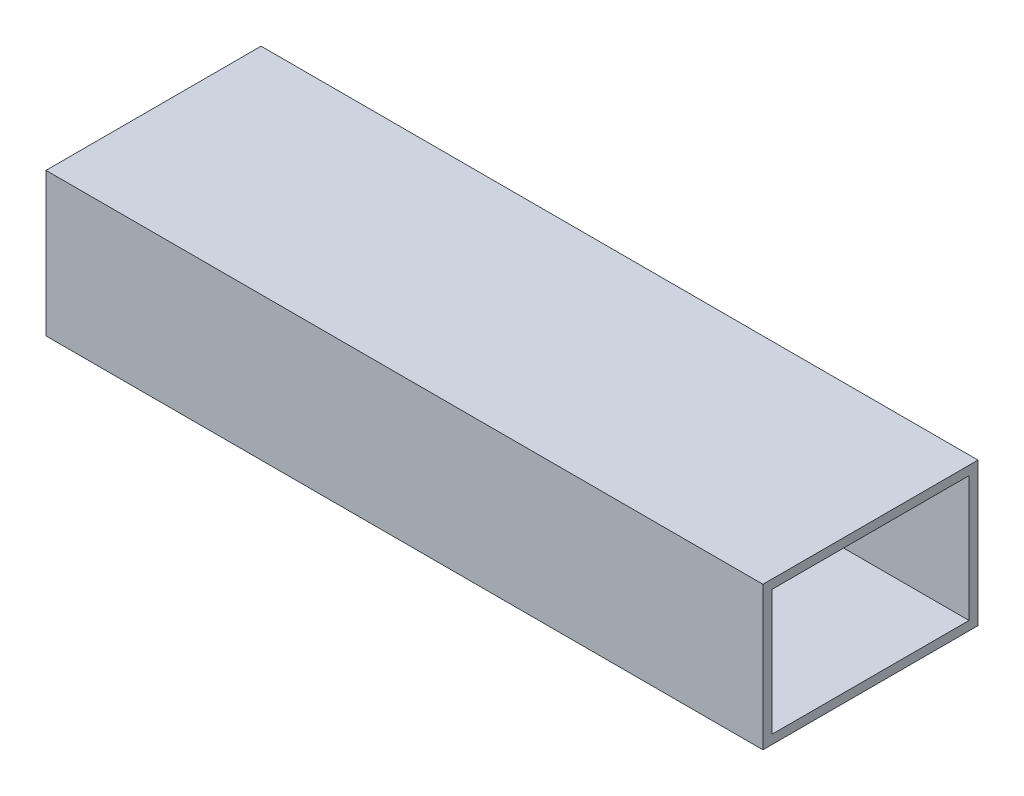
from build123d import *

# Parameters (mm, degrees)
SKETCH1_W           = 76.2
SKETCH1_H           = 50.8
SKETCH1_W_2         = 69.85
SKETCH1_H_2         = 44.45
BOSS_EXTRUDE1_DEPTH = 254


with BuildPart() as part:
    # Sketch1 → Boss-Extrude1 (new body)
    with BuildSketch(Plane(origin=(0, 0, 0), x_dir=(0, 0, -1), z_dir=(1, 0, 0))):
        Rectangle(SKETCH1_W, SKETCH1_H)
        Rectangle(SKETCH1_W_2, SKETCH1_H_2, mode=Mode.SUBTRACT)
    extrude(amount=BOSS_EXTRUDE1_DEPTH)


solid = part.part
